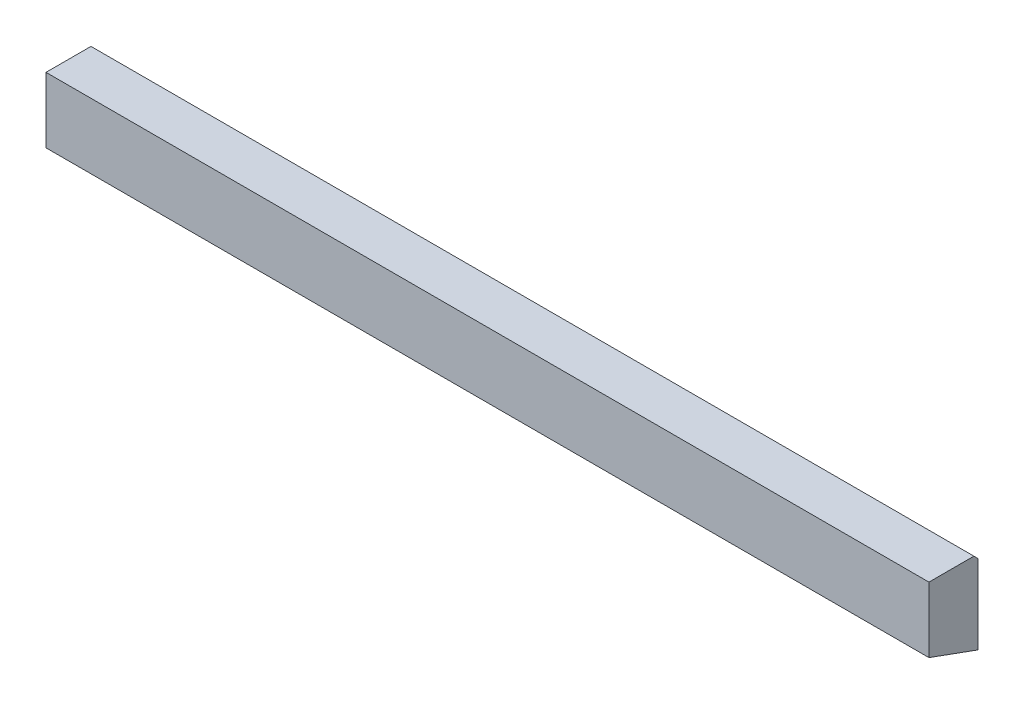
from build123d import *

# Parameters (mm, degrees)
EXTRUDE_1_DEPTH = 108
CHAMFER_1_SIZE  = 0.5


with BuildPart() as part:
    # 草图1 → 凸台-拉伸1 (new body)
    with BuildSketch(Plane(origin=(0, 0, 0), x_dir=(0, 0, -1), z_dir=(1, 0, 0))):
        Polygon((0, 8), (0, 0), (6, -2.183821406), (6, 8), align=None)
    extrude(amount=EXTRUDE_1_DEPTH)

    # 倒角1
    chamfer_1_edges = [part.edges().sort_by_distance(p)[0] for p in [
        (54, 8, -6),
    ]]
    chamfer(chamfer_1_edges, length=CHAMFER_1_SIZE)


solid = part.part
